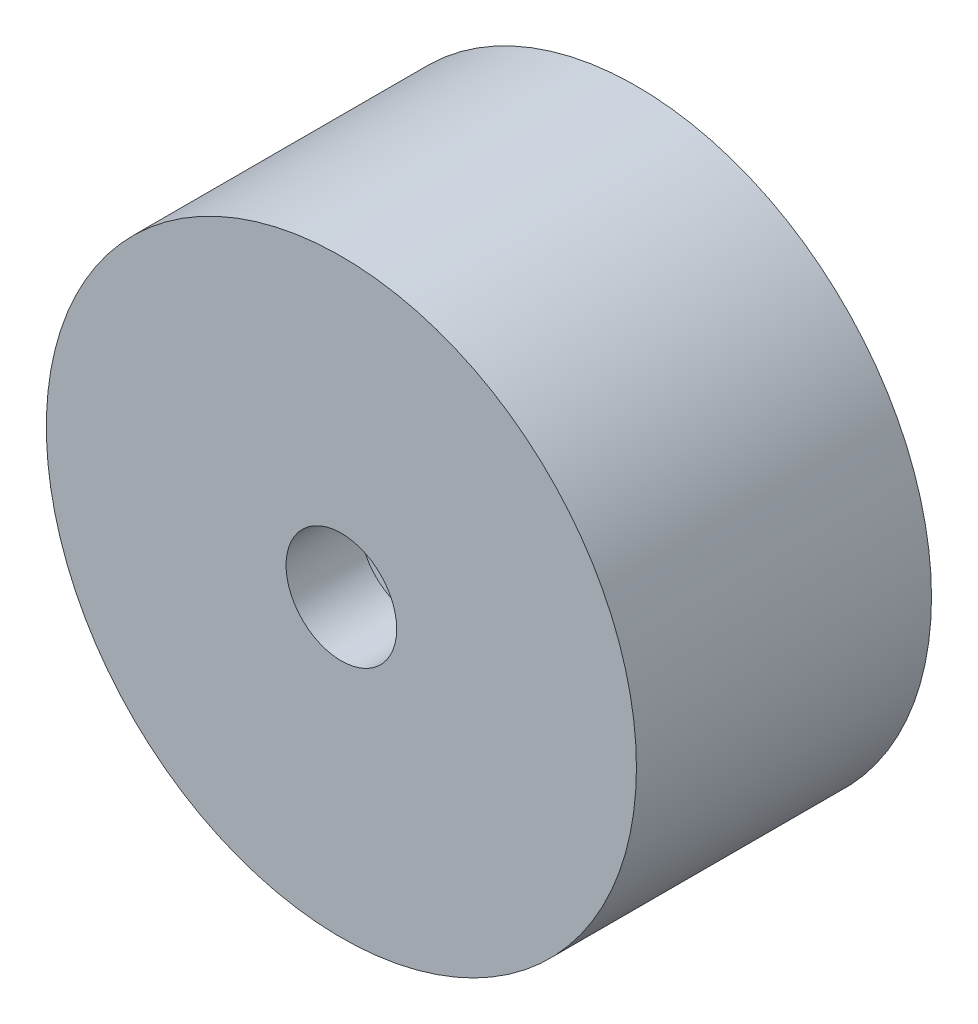
from build123d import *

# Parameters (mm, degrees)
SKETCH_1_R          = 8
EXTRUDE_1_DEPTH     = 8
SKETCH_2_R          = 6
CUT_EXTRUDE_1_DEPTH = 6
SKETCH_3_R          = 1.5
CUT_EXTRUDE_2_DEPTH = 14.856406461


with BuildPart() as part:
    # 草图1 → 凸台-拉伸1 (new body)
    with BuildSketch(Plane.XY):
        Circle(SKETCH_1_R)
    extrude(amount=EXTRUDE_1_DEPTH)

    # 草图2 → 切除-拉伸1 (cut)
    with BuildSketch(Plane(origin=(0, 0, 0), x_dir=(-1, 0, 0), z_dir=(0, 0, -1))):
        Circle(SKETCH_2_R)
    extrude(amount=-CUT_EXTRUDE_1_DEPTH, mode=Mode.SUBTRACT)

    # 草图3 → 切除-拉伸2 (cut, through all)
    with BuildSketch(Plane.XY.offset(8)):
        Circle(SKETCH_3_R)
    extrude(amount=-CUT_EXTRUDE_2_DEPTH, mode=Mode.SUBTRACT)


solid = part.part
